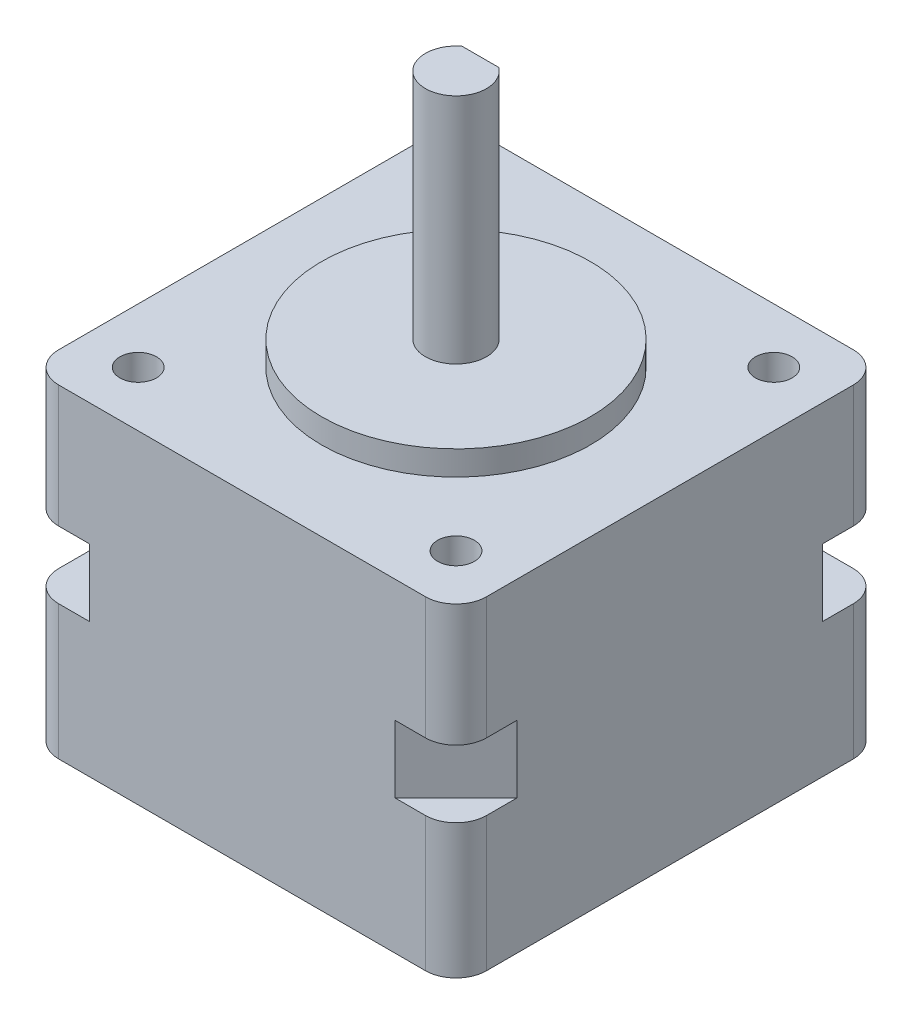
from build123d import *

# Parameters (mm, degrees)
ESQUISSE1_W                       = 35
ESQUISSE1_H                       = 35
BOSS_EXTRU_1_DEPTH                = 26.5
ESQUISSE2_R                       = 11
BOSS_EXTRU_2_DEPTH                = 2
BOSS_EXTRU_3_DEPTH                = 19
DIAM_TRE_DU_PER_AGE_3_0_3_1_D     = 3
DIAM_TRE_DU_PER_AGE_3_0_3_1_DEPTH = 4.2
DIAM_TRE_DU_PER_AGE_3_0_3_1_TIP   = 0.901290929
CONG_1_R                          = 2.5
ENL_V_START                       = 11
ENL_V_MAT_EXTRU_1_DEPTH           = 5.5
ESQUISSE5_R                       = 0.7
ESQUISSE5_R_2                     = 0.654723083
BOSS_EXTRU_4_DEPTH                = 10


with BuildPart() as part:
    # Esquisse1 → Boss.-Extru.1 (new body)
    with BuildSketch(Plane(origin=(0, 0, 0), x_dir=(1, 0, 0), z_dir=(0, 1, 0))):
        Rectangle(ESQUISSE1_W, ESQUISSE1_H)
    extrude(amount=BOSS_EXTRU_1_DEPTH)

    # Esquisse2 → Boss.-Extru.2 (add)
    with BuildSketch(Plane(origin=(0, 26.5, 0), x_dir=(1, 0, 0), z_dir=(0, 1, 0))):
        with Locations(Location((0, 0, 0), (0, 0, 270))):
            Circle(ESQUISSE2_R)
    extrude(amount=BOSS_EXTRU_2_DEPTH)

    # Esquisse3 → Boss.-Extru.3 (add)
    with BuildSketch(Plane(origin=(0, 28.5, 0), x_dir=(1, 0, 0), z_dir=(0, 1, 0))):
        with BuildLine():
            Line((-1.5, 2), (1.5, 2))
            ThreePointArc((1.5, 2), (0, -2.5), (-1.5, 2))
        make_face()
    extrude(amount=BOSS_EXTRU_3_DEPTH)

    # Diamètre du perçage Ø3.0 (3)1
    with Locations(Plane(origin=(0, 26.5, 0), x_dir=(1, 0, 0), z_dir=(0, 1, 0))):
        with Locations((-13, 13), (13, 13), (13, -13), (-13, -13)):
            Hole(DIAM_TRE_DU_PER_AGE_3_0_3_1_D / 2, depth=DIAM_TRE_DU_PER_AGE_3_0_3_1_DEPTH)
            with Locations((0, 0, -(DIAM_TRE_DU_PER_AGE_3_0_3_1_DEPTH + DIAM_TRE_DU_PER_AGE_3_0_3_1_TIP / 2))):  # 118° drill point
                Cone(0, DIAM_TRE_DU_PER_AGE_3_0_3_1_D / 2, DIAM_TRE_DU_PER_AGE_3_0_3_1_TIP, mode=Mode.SUBTRACT)

    # Congé1
    cong_1_edges = [part.edges().sort_by_distance(p)[0] for p in [
        (-17.5, 13.25, -17.5),
        (17.5, 13.25, -17.5),
        (17.5, 13.25, 17.5),
        (-17.5, 13.25, 17.5),
    ]]
    fillet(cong_1_edges, radius=CONG_1_R)

    # Esquisse4 → Enlèv. mat.-Extru.1 (cut)
    with BuildSketch(Plane(origin=(0, 0, 0), x_dir=(1, 0, 0), z_dir=(0, 1, 0)).offset(ENL_V_START)):
        Polygon((-12.5, 17.5), (-17.5, 12.5), (-17.5, 17.5), align=None)
        Polygon((17.5, 17.5), (12.5, 17.5), (17.5, 12.5), align=None)
        Polygon((12.5, -17.5), (17.5, -12.5), (17.5, -17.5), align=None)
        Polygon((-17.5, -17.5), (-12.5, -17.5), (-17.5, -12.5), align=None)
    extrude(amount=ENL_V_MAT_EXTRU_1_DEPTH, mode=Mode.SUBTRACT)

    # Esquisse5 → Boss.-Extru.4 (add)
    with BuildSketch(Plane.ZY.offset(17.5)):
        with Locations(Location((-1, 7, 0), (0, 0, 180))):
            Circle(ESQUISSE5_R)
        with Locations(Location((-1, 5, 0), (0, 0, 180))):
            Circle(ESQUISSE5_R_2)
        with Locations(Location((1, 5, 0), (0, 0, 180))):
            Circle(ESQUISSE5_R_2)
        with Locations(Location((1, 7, 0), (0, 0, 180))):
            Circle(ESQUISSE5_R)
    extrude(amount=BOSS_EXTRU_4_DEPTH)


solid = part.part
